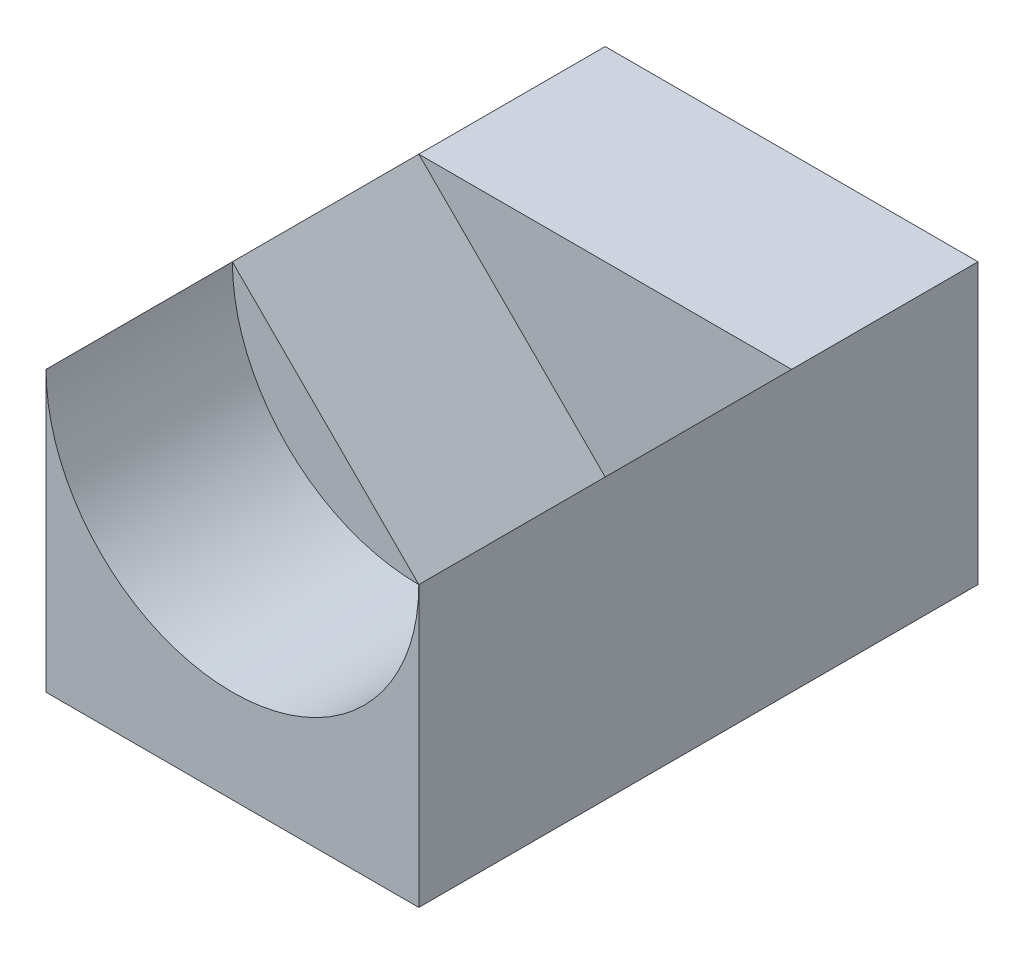
from build123d import *

# Parameters (mm, degrees)
SKETCH_1_W          = 20
SKETCH_1_H          = 30
EXTRUDE_1_DEPTH     = 15
SKETCH_2_R          = 10
CUT_EXTRUDE_1_DEPTH = 10
CUT_EXTRUDE_2_DEPTH = 10


with BuildPart() as part:
    # 草圖1 → 填料-伸長1 (new body)
    with BuildSketch(Plane(origin=(0, 0, 0), x_dir=(1, 0, 0), z_dir=(0, 1, 0))):
        Rectangle(SKETCH_1_W, SKETCH_1_H)
    extrude(amount=-EXTRUDE_1_DEPTH)

    # 草圖2 → 除料-伸長1 (cut)
    with BuildSketch(Plane.XY.offset(15)):
        Circle(SKETCH_2_R)
    extrude(amount=-CUT_EXTRUDE_1_DEPTH, mode=Mode.SUBTRACT)

    # 草圖3 → 除料-伸長2 (cut)
    with BuildSketch(Plane.XY.offset(5)):
        Polygon((-10, 0), (0, -10), (10, 0), align=None)
    extrude(amount=-CUT_EXTRUDE_2_DEPTH, mode=Mode.SUBTRACT)


solid = part.part
